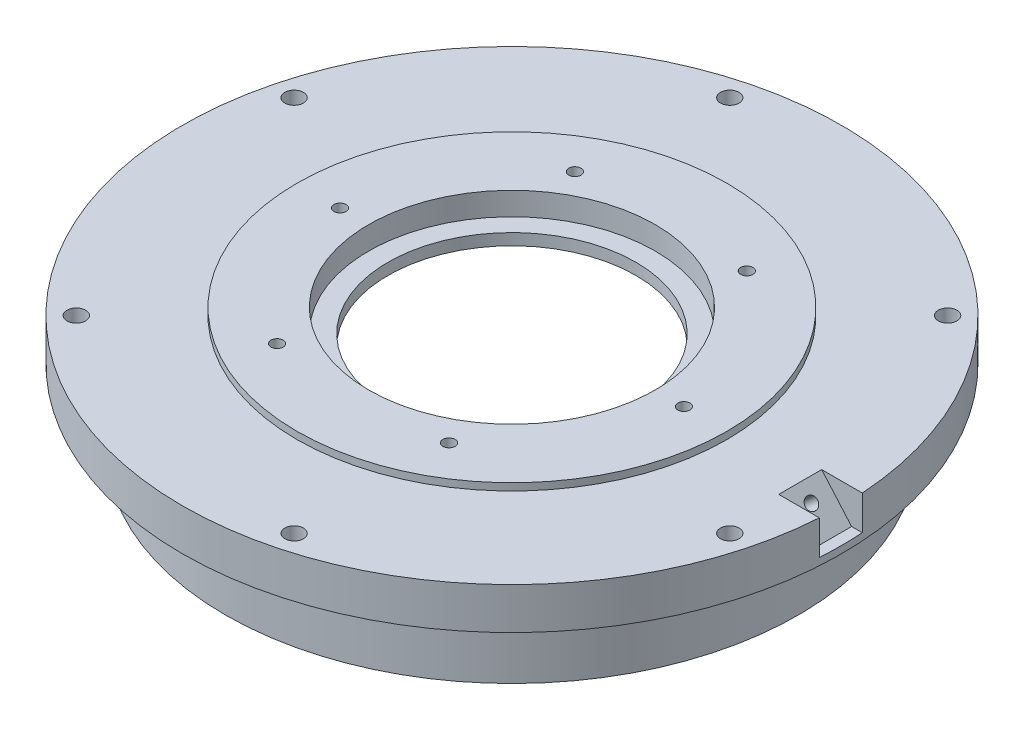
from build123d import *

# Parameters (mm, degrees)
CUT_EXTRUDE_1_DEPTH      = 15
SKETCH_3_R               = 4.25
CUT_EXTRUDE_2_DEPTH      = 20
PATTERN_CIRCULAR_1_COUNT = 6
CUT_EXTRUDE_3_REACH      = 337.203
SKETCH_4_R               = 6.5
PATTERN_CIRCULAR_2_COUNT = 6
SKETCH_5_R               = 4.25
CUT_EXTRUDE_4_DEPTH      = 20
CUT_EXTRUDE_5_REACH      = 453.217
SKETCH_6_R               = 4


with BuildPart() as part:
    # 草图1 → 旋转1 (revolve)
    with BuildSketch(Plane.XY, mode=Mode.PRIVATE) as revolve_1_sk:
        Polygon((-150, 0), (-100, 0), (-100, -16), (-86.5, -16), (-86.5, -24), (-170, -24), (-190, -44), (-190, -54.5), (-180, -54.5), (-180, -76), (-195, -76), (-195, -86), (-200, -86), (-200, -34), (-230, -34), (-230, -5), (-150, -5), align=None)
    revolve(revolve_1_sk.sketch.rotate(Axis((0, 0, 0), (0, -1, 0)), 270), axis=Axis((0, 0, 0), (0, -1, 0)))

    # 草图2 → 切除-拉伸1 (cut, symmetric)
    with BuildSketch(Plane.XY):
        Polygon((201.17641936, -5), (222.039301067, -29), (230, -29), (230, -5), align=None)
    extrude(amount=CUT_EXTRUDE_1_DEPTH, both=True, mode=Mode.SUBTRACT)

    # 草图3 → 切除-拉伸2 (cut)
    with BuildSketch(Plane(origin=(0, 0, 0), x_dir=(1, 0, 0), z_dir=(0, 1, 0))):
        with Locations(Location((120, 0, 0), (0, 0, 270))):
            Circle(SKETCH_3_R)
    cut_extrude_2 = extrude(amount=-CUT_EXTRUDE_2_DEPTH, mode=Mode.SUBTRACT)

    # 阵列(圆周)1: 切除-拉伸2 ×6 about axis
    pattern_circular_1_axis = Axis((0, 0, 0), (0, 1, 0))
    for i in range(1, PATTERN_CIRCULAR_1_COUNT):
        add(cut_extrude_2.rotate(pattern_circular_1_axis, i * 360 / PATTERN_CIRCULAR_1_COUNT), mode=Mode.SUBTRACT)

    # 草图4 → 切除-拉伸3 (cut, up to next)
    with BuildSketch(Plane(origin=(0, -5, 0), x_dir=(1, 0, 0), z_dir=(0, 1, 0)), mode=Mode.PRIVATE) as cut_extrude_3_sk1:
        with Locations(Location((55.646094697, -207.674052652, 0), (0, 0, 270))):
            Circle(SKETCH_4_R)
    cut_extrude_3_tool1 = extrude(cut_extrude_3_sk1.sketch, amount=-CUT_EXTRUDE_3_REACH, mode=Mode.PRIVATE) & part.part
    cut_extrude_3 = cut_extrude_3_tool1.solids().sort_by_distance((55.646095, -5, 207.674053))[0]
    add(cut_extrude_3, mode=Mode.SUBTRACT)

    # 阵列(圆周)2: 切除-拉伸3 ×6 about axis
    pattern_circular_2_axis = Axis((0, 0, 0), (0, 1, 0))
    for i in range(1, PATTERN_CIRCULAR_2_COUNT):
        add(cut_extrude_3.rotate(pattern_circular_2_axis, i * 360 / PATTERN_CIRCULAR_2_COUNT), mode=Mode.SUBTRACT)

    # 草图5 → 切除-拉伸4 (cut)
    with BuildSketch(Plane(origin=(112.111712569, 97.45722489, 0), x_dir=(0, 0, -1), z_dir=(0.7547095802227705, 0.656059028990509, 0))):
        with Locations(Location((0, -147.682271182, 0), (0, 0, 90))):
            Circle(SKETCH_5_R)
    extrude(amount=-CUT_EXTRUDE_4_DEPTH, mode=Mode.SUBTRACT)

    # 切除-拉伸5: up to this cone (the profile starts outside it)
    cut_extrude_5_end = Plane(origin=(0, -14, 0), z_dir=(0, -1, 0)).offset(-159.999999) * Cone(1e-06, 773.717, 773.716999, align=(Align.CENTER, Align.CENTER, Align.MIN), mode=Mode.PRIVATE)
    # 草图6 → 切除-拉伸5 (cut, up to the surface)
    with BuildSketch(Plane(origin=(112.111712569, 97.45722489, 0), x_dir=(0, 0, -1), z_dir=(0.7547095802227705, 0.656059028990509, 0)), mode=Mode.PRIVATE) as cut_extrude_5_sk1:
        with Locations(Location((0, -147.682271182, 0), (0, 0, 90))):
            Circle(SKETCH_6_R)
    cut_extrude_5_tool1 = extrude(cut_extrude_5_sk1.sketch, amount=-CUT_EXTRUDE_5_REACH, mode=Mode.PRIVATE) - cut_extrude_5_end
    add(cut_extrude_5_tool1.solids().sort_by_distance((209, -14, 0))[0], mode=Mode.SUBTRACT)


solid = part.part
